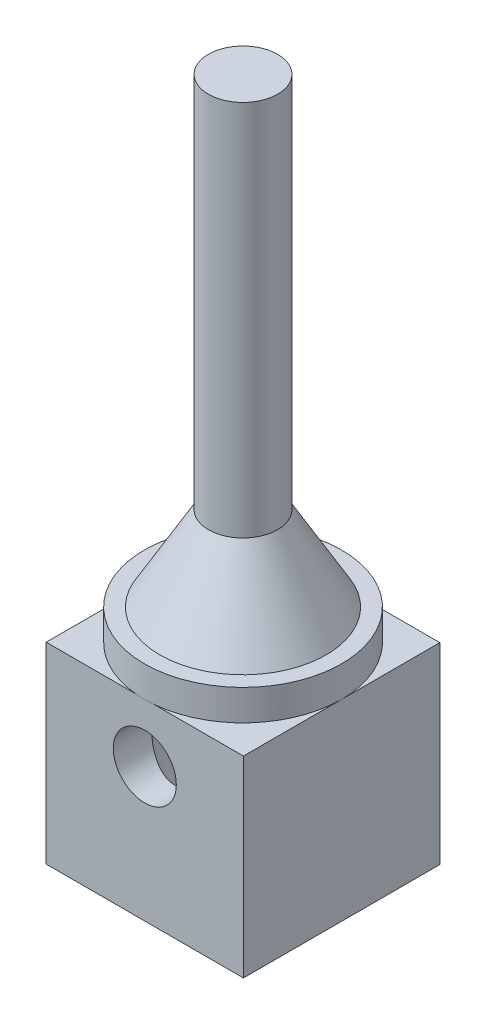
from build123d import *

# Parameters (mm, degrees)
SKETCH4_W           = 13.0302
SKETCH4_H           = 12.976851724
SKETCH4_R           = 4.4831
BOSS_EXTRUDE3_DEPTH = 12.7
SKETCH5_R           = 2.0828
CUT_EXTRUDE4_DEPTH  = 15.24
SKETCH6_R           = 6.5151
BOSS_EXTRUDE4_DEPTH = 2.032
SKETCH7_R           = 2.286
BOSS_EXTRUDE6_DEPTH = 30.48
CHAMFER1_SIZE       = 3.20923319
CHAMFER1_SIZE2      = 5.558554938


with BuildPart() as part:
    # Sketch4 → Boss-Extrude3 (new body)
    with BuildSketch(Plane(origin=(0, 0, 0), x_dir=(1, 0, 0), z_dir=(0, 1, 0))):
        Rectangle(SKETCH4_W, SKETCH4_H)
        with Locations(Location((0, 0, 0), (0, 0, 270))):
            Circle(SKETCH4_R, mode=Mode.SUBTRACT)
    extrude(amount=BOSS_EXTRUDE3_DEPTH)

    # Sketch5 → Cut-Extrude4 (cut)
    with BuildSketch(Plane.XY.offset(6.488425862)):
        with Locations((0, 8.8392)):
            Circle(SKETCH5_R)
    extrude(amount=-CUT_EXTRUDE4_DEPTH, mode=Mode.SUBTRACT)

    # Sketch6 → Boss-Extrude4 (add)
    with BuildSketch(Plane(origin=(0, 12.7, 0), x_dir=(1, 0, 0), z_dir=(0, 1, 0))):
        with Locations(Location((0, 0, 0), (0, 0, 84.813545561))):
            Circle(SKETCH6_R)
    extrude(amount=BOSS_EXTRUDE4_DEPTH)

    # Sketch7 → Boss-Extrude6 (add)
    with BuildSketch(Plane(origin=(0, 14.732, 0), x_dir=(1, 0, 0), z_dir=(0, 1, 0))):
        with Locations(Location((0, 0, 0), (0, 0, 90))):
            Circle(SKETCH7_R)
    extrude(amount=BOSS_EXTRUDE6_DEPTH)

    # Chamfer1
    chamfer1_edges = [part.edges().sort_by_distance(p)[0] for p in [
        (0, 14.732, 2.286),
    ]]
    chamfer1_side = [part.faces().sort_by_distance(p)[0] for p in [
        (-0.572288462, 14.732, 6.304905465),
    ]]
    chamfer(chamfer1_edges, length=CHAMFER1_SIZE, length2=CHAMFER1_SIZE2, reference=chamfer1_side[0])


solid = part.part
